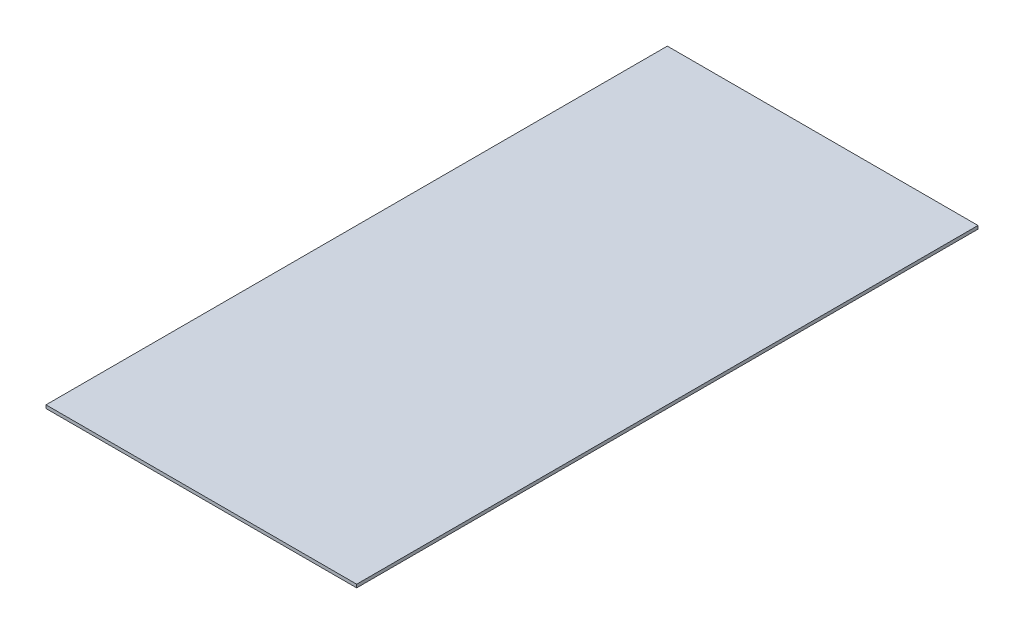
from build123d import *

# Parameters (mm, degrees)
SKETCH1_W           = 1219.2
SKETCH1_H           = 2438.4
BOSS_EXTRUDE1_DEPTH = 12.7


with BuildPart() as part:
    # Sketch1 → Boss-Extrude1 (new body)
    with BuildSketch(Plane(origin=(0, 0, 0), x_dir=(1, 0, 0), z_dir=(0, 1, 0))):
        Rectangle(SKETCH1_W, SKETCH1_H)
    extrude(amount=BOSS_EXTRUDE1_DEPTH)


solid = part.part
